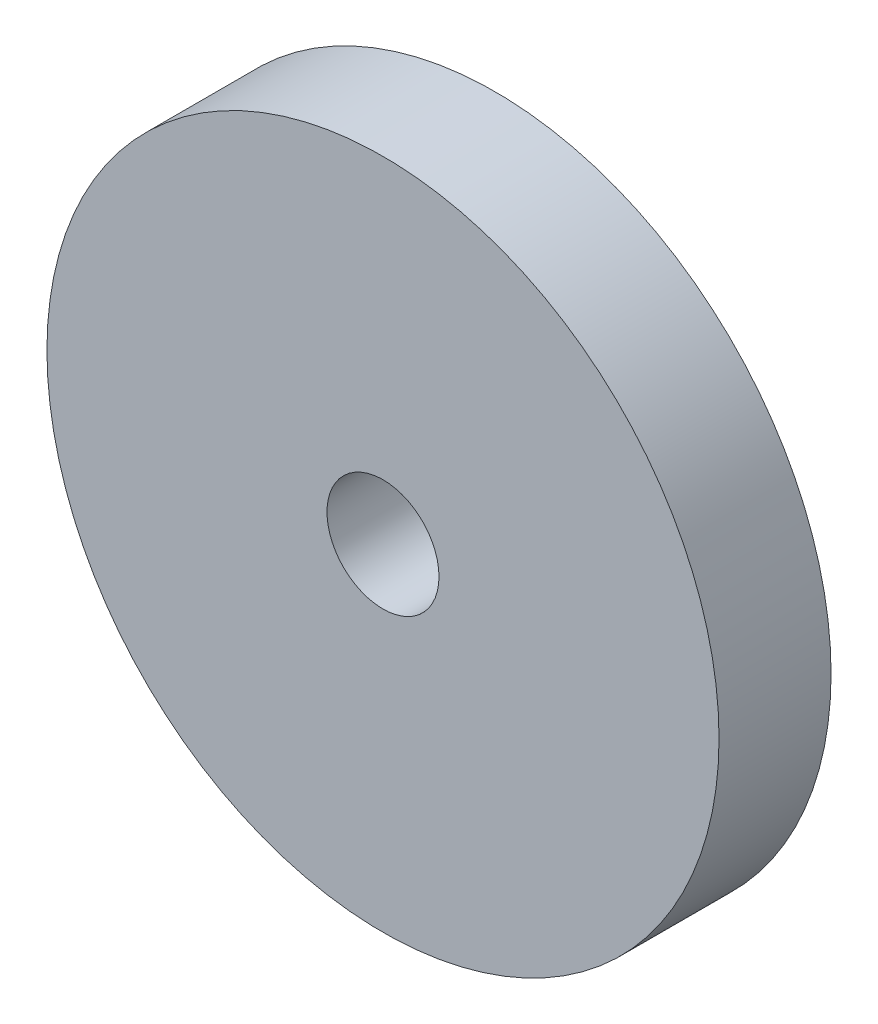
from build123d import *

# Parameters (mm, degrees)
MODEL_R                 = 9
MODEL_R_2               = 1.5
SALIENTE_EXTRUIR1_DEPTH = 3


with BuildPart() as part:
    # Model → Saliente-Extruir1 (new body)
    with BuildSketch(Plane.XY):
        with Locations((18.564275107, 286.974821193)):
            Circle(MODEL_R)
        with Locations((18.564275107, 286.974821193)):
            Circle(MODEL_R_2, mode=Mode.SUBTRACT)
    extrude(amount=SALIENTE_EXTRUIR1_DEPTH)


solid = part.part
